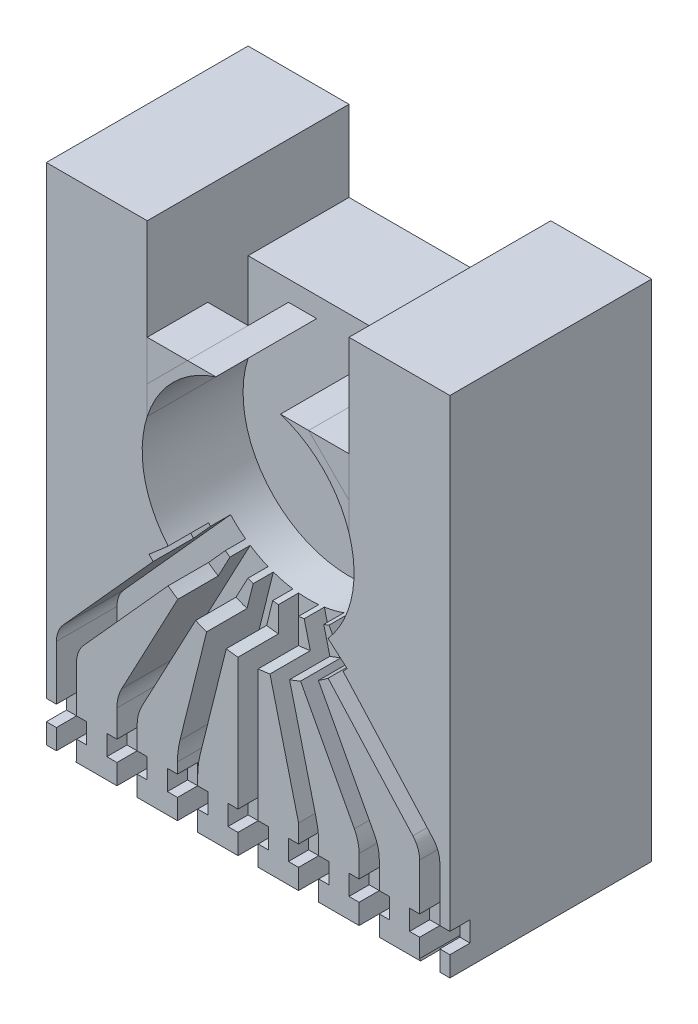
from build123d import *

# Parameters (mm, degrees)
BOSS_EXTRUDE1_DEPTH   = 100
SKETCH6_W             = 200
SKETCH6_H             = 100.00000000000001
BOSS_EXTRUDE2_DEPTH   = 50
CUT_EXTRUDE7_DEPTH    = 50
CUT_EXTRUDE13_DEPTH   = 50
CUT_EXTRUDE16_DEPTH   = 50
CUT_EXTRUDE17_DEPTH   = 50
BOSS_EXTRUDE5_DEPTH   = 100
SKETCH11_W            = 100
SKETCH11_H            = 50.00000000000001
CUT_EXTRUDE29_DEPTH   = 40
BOSS_EXTRUDE7_DEPTH   = 30
BOSS_EXTRUDE7_2_DEPTH = 30
BOSS_EXTRUDE8_START   = -70
BOSS_EXTRUDE8_DEPTH   = 70
SKETCH14_W            = 5.0000000000006395
SKETCH14_H            = 10
CUT_EXTRUDE31_DEPTH   = 10
SKETCH24_W            = 5.000000000000001
SKETCH24_H            = 10.000000000000014
SKETCH24_W_2          = 5
CUT_EXTRUDE32_DEPTH   = 10
CUT_EXTRUDE33_DEPTH   = 30
SKETCH13_R            = 10.000000000000002
CUT_EXTRUDE34_DEPTH   = 50
SKETCH28_R            = 52.49999999999999
SKETCH28_R_2          = 50
CUT_EXTRUDE35_DEPTH   = 50
CUT_EXTRUDE37_DEPTH   = 60
CUT_EXTRUDE39_DEPTH   = 20


with BuildPart() as part:
    # Sketch1 → Boss-Extrude1 (new body)
    with BuildSketch(Plane.XY):
        Polygon((-100.00000000000003, 100), (99.99999999999997, 100), (100, -100), (-100, -100), align=None)
    extrude(amount=-BOSS_EXTRUDE1_DEPTH)

    # Sketch6 → Boss-Extrude2 (add)
    with BuildSketch(Plane(origin=(0, 100, 0), x_dir=(1, 0, 0), z_dir=(0, 1, 0))):
        with Locations((-2.842e-14, 50.00000000000001)):
            Rectangle(SKETCH6_W, SKETCH6_H)
    extrude(amount=BOSS_EXTRUDE2_DEPTH)

    # Sketch8 → Cut-Extrude7 (cut)
    with BuildSketch(Plane.XY):
        with BuildLine():
            Line((0, 100), (-50, 100))
            Line((-49.99999999999999, 100), (-49.99999999999999, 50))
            ThreePointArc((-49.99999999999999, 50.00000000000001), (-35.35533905932736, 85.35533905932738), (-2.71e-15, 100))
        make_face()
        with BuildLine():
            Line((50.00000000000001, 50), (50, 100))
            Line((50, 100), (0, 100))
            ThreePointArc((-1.381e-14, 100), (35.35533905932738, 85.35533905932738), (50.00000000000001, 50))
        make_face()
        Polygon((49.99999999999999, 150.00000000000003), (-49.99999999999999, 150.00000000000003), (-49.99999999999999, 100), (0, 100), (50, 100), align=None)
    extrude(amount=-CUT_EXTRUDE7_DEPTH, mode=Mode.SUBTRACT)

    # Sketch3<9> → Cut-Extrude13 (cut)
    with BuildSketch(Plane.XY):
        with BuildLine():
            Line((9.18e-15, 50), (0, 100))
            ThreePointArc((1.14e-15, 100), (-2.503138752990941, 99.93730365551664), (-4.999999999999985, 99.74937185533099))
            ThreePointArc((-4.999999999999985, 99.74937185533099), (-37.0809924354783, 83.54101966249685), (-49.99999999999999, 50.00000000000001))
            Line((-49.99999999999999, 50), (-39.99999999999999, 50))
            Line((-39.99999999999999, 50), (-29.999999999999993, 50))
            Line((-29.999999999999993, 50), (-19.999999999999993, 50))
            Line((-19.999999999999993, 50), (-9.999999999999993, 50))
            Line((-9.999999999999993, 50), (9.18e-15, 50))
        make_face()
        with BuildLine():
            ThreePointArc((5.00000000000002, 99.74937185533099), (2.503138752990955, 99.93730365551664), (1.14e-15, 100))
            Line((0, 100), (9.18e-15, 50))
            Line((9.18e-15, 50), (10.000000000000007, 50))
            Line((10.000000000000007, 50), (20.000000000000007, 50))
            Line((20.000000000000007, 50), (30.000000000000007, 50))
            Line((30.000000000000007, 50), (40.00000000000001, 50))
            Line((40.00000000000001, 50), (50.00000000000001, 50))
            ThreePointArc((50.00000000000001, 50), (37.08099243547832, 83.54101966249684), (5.00000000000002, 99.74937185533099))
        make_face()
        with BuildLine():
            Line((-33.45653031794294, 12.842758726130342), (9.18e-15, 50))
            Line((9.18e-15, 50), (-9.999999999999993, 50))
            Line((-9.999999999999993, 50), (-19.999999999999993, 50))
            Line((-19.999999999999993, 50), (-29.999999999999993, 50))
            Line((-29.999999999999993, 50), (-39.99999999999999, 50))
            Line((-39.99999999999999, 50), (-49.99999999999999, 50))
            ThreePointArc((-49.99999999999999, 50.00000000000001), (-46.638115174960966, 31.97539978454238), (-37.00455148291699, 16.374664766754435))
            ThreePointArc((-37.00455148291699, 16.374664766754435), (-35.27477288667937, 14.564277941698585), (-33.4565303179427, 12.842758726130107))
        make_face()
        with BuildLine():
            Line((10.000000000000007, 50), (9.18e-15, 50))
            Line((9.18e-15, 50), (33.45653031794303, 12.842758726130398))
            ThreePointArc((33.4565303179428, 12.842758726130185), (35.274772886679195, 14.5642779416984), (37.004551482916575, 16.374664766753966))
            ThreePointArc((37.004551482916575, 16.374664766753966), (46.63811517496086, 31.975399784542073), (50.00000000000001, 49.999999999999986))
            Line((50.00000000000001, 50), (40.00000000000001, 50))
            Line((40.00000000000001, 50), (30.000000000000007, 50))
            Line((30.000000000000007, 50), (20.000000000000007, 50))
            Line((20.000000000000007, 50), (10.000000000000007, 50))
        make_face()
        with BuildLine():
            Line((-31.851655647969743, 11.458178137467897), (9.18e-15, 50))
            Line((9.18e-15, 50), (-33.45653031794294, 12.842758726130342))
            ThreePointArc((-33.4565303179427, 12.842758726130107), (-32.66143068500176, 12.141963262619853), (-31.85165564796974, 11.458178137467904))
        make_face()
        with BuildLine():
            Line((-28.678821817552357, 9.042397785550442), (9.18e-15, 50))
            Line((9.18e-15, 50), (-31.851655647969743, 11.458178137467897))
            ThreePointArc((-31.85165564796974, 11.458178137467904), (-30.28933268047004, 10.218643490049153), (-28.678821817552127, 9.042397785550293))
        make_face()
        with BuildLine():
            Line((-23.473578139294574, 5.852620357053681), (9.18e-15, 50))
            Line((9.18e-15, 50), (-28.678821817552357, 9.042397785550442))
            ThreePointArc((-28.678821817552127, 9.042397785550293), (-26.124928235797764, 7.36799178229559), (-23.47357813929539, 5.852620357054114))
        make_face()
        with BuildLine():
            Line((-12.096094779983398, 1.48521368620019), (9.18e-15, 50))
            Line((9.18e-15, 50), (-23.473578139294574, 5.852620357053681))
            ThreePointArc((-23.47357813929539, 5.852620357054114), (-17.918397477264612, 3.320978675139763), (-12.096094779981614, 1.4852136861997352))
        make_face()
        with BuildLine():
            Line((0, 0), (9.18e-15, 50))
            Line((9.18e-15, 50), (-12.096094779983398, 1.48521368620019))
            ThreePointArc((-12.096094779981614, 1.4852136861997352), (-6.093467170256468, 0.3726924179337914), (0, 0))
        make_face()
        with BuildLine():
            Line((12.096094779983442, 1.485213686200197), (9.18e-15, 50))
            Line((9.18e-15, 50), (0, 0))
            ThreePointArc((0, 0), (6.093467170256467, 0.37269241793378427), (12.096094779981614, 1.4852136861997352))
        make_face()
        with BuildLine():
            Line((23.47357813929465, 5.852620357053695), (9.18e-15, 50))
            Line((9.18e-15, 50), (12.096094779983442, 1.485213686200197))
            ThreePointArc((12.096094779981614, 1.4852136861997352), (17.91839747726453, 3.3209786751397274), (23.473578139295277, 5.852620357054036))
        make_face()
        with BuildLine():
            Line((31.851655647969828, 11.458178137467954), (9.18e-15, 50))
            Line((9.18e-15, 50), (23.47357813929465, 5.852620357053695))
            ThreePointArc((23.473578139295277, 5.852620357054036), (27.804243253706357, 8.443724215363993), (31.85165564796981, 11.458178137467954))
        make_face()
        with BuildLine():
            Line((33.45653031794303, 12.842758726130398), (9.18e-15, 50))
            Line((9.18e-15, 50), (31.851655647969828, 11.458178137467954))
            ThreePointArc((31.85165564796981, 11.458178137467954), (32.66143068500187, 12.141963262619925), (33.4565303179428, 12.842758726130185))
        make_face()
    extrude(amount=-CUT_EXTRUDE13_DEPTH, mode=Mode.SUBTRACT)

    # Sketch9 → Cut-Extrude16 (cut)
    with BuildSketch(Plane.XY):
        with BuildLine():
            Line((-37.00455148291699, 16.374664766754428), (-38.68540123985281, 14.507891991153953))
            ThreePointArc((-38.68540123985282, 14.507891991153947), (-3.0986e-13, -2.500000000000007), (38.685401239852396, 14.507891991153485))
            Line((38.68540123985239, 14.507891991153473), (37.004551482916575, 16.374664766753963))
            ThreePointArc((37.004551482916575, 16.374664766753945), (-3.2005e-13, -2.132e-14), (-37.004551482917, 16.37466476675442))
        make_face()
    extrude(amount=-CUT_EXTRUDE16_DEPTH, mode=Mode.SUBTRACT)

    # Sketch3<12> → Cut-Extrude17 (cut)
    with BuildSketch(Plane.XY):
        with BuildLine():
            ThreePointArc((5.0000000000000195, -2.2613624009171787), (1.51e-14, -2.5), (-4.99999999999999, -2.2613624009171787))
            Line((-4.99999999999999, -2.2613624009171702), (-4.99999999999999, -100))
            Line((-4.99999999999999, -100), (5.000000000000019, -100))
            Line((5.000000000000019, -100), (5.000000000000019, -2.2613624009171645))
        make_face()
        with BuildLine():
            ThreePointArc((-31.25395298507802, 7.816585927564702), (-35.12935683383976, 10.98489666243654), (-38.685401239852816, 14.507891991153947))
            Line((-38.68540123985281, 14.507891991153953), (-91.65434696820584, -44.32008203206311))
            ThreePointArc((-91.65434696820584, -44.32008203206311), (-94.13485547693077, -48.36790402696407), (-94.99999999999939, -53.03580615944982))
            Line((-94.99999999999939, -53.03580615944982), (-94.99999999999939, -100))
            Line((-94.99999999999939, -100), (-85.4192650026672, -100))
            Line((-85.4192650026672, -100), (-84.99999999999939, -99.21147721348915))
            Line((-84.99999999999939, -99.21147721348915), (-84.99999999999937, -56.87444650980339))
            ThreePointArc((-84.99999999999937, -56.87444650980339), (-84.13485547693067, -52.20654437731811), (-81.65434696820557, -48.15872238241778))
            Line((-81.65434696820557, -48.15872238241778), (-31.25395298507801, 7.8165859275647165))
        make_face()
        with BuildLine():
            ThreePointArc((38.68540123985238, 14.507891991153478), (35.129356833840156, 10.984896662436888), (31.253952985079387, 7.816585927565711))
            Line((31.25395298507938, 7.816585927565713), (81.65434696820574, -48.158722382416414))
            ThreePointArc((81.65434696820574, -48.158722382416414), (84.13485547693118, -52.20654437731739), (85, -56.8744465098034))
            Line((85, -56.8744465098034), (85, -99.21147721348999))
            Line((85, -99.21147721348997), (85.41926500266737, -100))
            Line((85.41926500266737, -100), (95, -100))
            Line((95, -100), (94.99999999999991, -53.03580615945003))
            ThreePointArc((94.99999999999991, -53.03580615945003), (94.13485547693111, -48.36790402696403), (91.6543469682056, -44.320082032063105))
            Line((91.6543469682056, -44.320082032063105), (38.68540123985239, 14.507891991153478))
        make_face()
        with BuildLine():
            ThreePointArc((28.949961443973052, 6.203313682511627), (24.6472570462596, 3.6452513749065076), (20.1204855153844, 1.508598054652964))
            Line((20.120485515384395, 1.508598054652964), (52.652642186070594, -59.67548997069998))
            ThreePointArc((52.652642186070594, -59.67548997069998), (54.40431332651623, -64.23874930361463), (55.00000000000005, -69.09022793499462))
            Line((55.00000000000005, -69.09022793499462), (55.00000000000005, -100))
            Line((55.00000000000006, -100), (65, -100))
            Line((65, -100), (64.99999999999999, -66.59694790656346))
            ThreePointArc((64.99999999999999, -66.59694790656346), (64.40431332651615, -61.745469275183424), (62.652642186070466, -57.18220994226872))
            Line((62.65264218607047, -57.18220994226872), (28.949961443973045, 6.203313682511634))
        make_face()
        with BuildLine():
            Line((-17.494646490031172, 0.5006328910273916), (-33.79039052200022, -64.85802657017483))
            ThreePointArc((-33.79039052200022, -64.85802657017483), (-34.69646638372632, -69.74677444335386), (-34.99999999999997, -74.70950520156622))
            Line((-34.99999999999997, -74.70950520156622), (-35.00000000000001, -100))
            Line((-35.00000000000001, -100), (-25.000000000000007, -100))
            Line((-25.000000000000007, -100), (-24.99999999999997, -75.93735081059135))
            ThreePointArc((-24.999999999999975, -75.93735081059135), (-24.696466383726506, -70.97462005238268), (-23.79039052200113, -66.08587217920726))
            Line((-23.790390522001125, -66.08587217920726), (-7.791689227271171, -1.918586064969304))
            ThreePointArc((-7.7916892272711715, -1.9185860649693183), (-12.700899518982641, -0.940525629489791), (-17.494646490031172, 0.5006328910273936))
        make_face()
        with BuildLine():
            ThreePointArc((17.494646490028806, 0.5006328910265552), (12.700899518981458, -0.9405256294900823), (7.791689227271249, -1.9185860649693112))
            Line((7.791689227271249, -1.9185860649692938), (25.000000000000686, -70.93735081059185))
            Line((25.0000000000007, -70.93735081059185), (25.000000000000494, -100))
            Line((25.000000000000494, -100), (35.00000000000003, -100))
            Line((35.00000000000003, -100), (35.00000000000004, -74.70950520156617))
            ThreePointArc((35.00000000000004, -74.70950520156617), (34.6964663837267, -69.74677444335956), (33.79039052200163, -64.8580265701862))
            Line((33.79039052200162, -64.8580265701862), (17.494646490028806, 0.5006328910265552))
        make_face()
        with BuildLine():
            ThreePointArc((-20.12048551538437, 1.508598054652957), (-24.6472570462596, 3.6452513749065076), (-28.94996144397308, 6.203313682511649))
            Line((-28.949961443973077, 6.203313682511647), (-55.000000000000036, -42.78968325310052))
            Line((-55.00000000000005, -42.78968325310051), (-62.65264218607062, -57.18220994226922))
            ThreePointArc((-62.65264218607062, -57.18220994226922), (-64.40431332651619, -61.74546927518374), (-64.99999999999999, -66.59694790656357))
            Line((-64.99999999999999, -66.59694790656357), (-64.99999999999999, -72.24722024751124))
            Line((-64.99999999999999, -72.24722024751124), (-65, -100))
            Line((-65, -100), (-55.000000000000036, -100))
            Line((-55.000000000000036, -100), (-55.000000000000036, -69.09022793499462))
            ThreePointArc((-55.000000000000036, -69.09022793499462), (-54.404313326516174, -64.23874930361461), (-52.65264218607042, -59.675489970699985))
            Line((-52.65264218607042, -59.675489970699985), (-20.120485515384367, 1.508598054652957))
        make_face()
    extrude(amount=-CUT_EXTRUDE17_DEPTH, mode=Mode.SUBTRACT)

    # Sketch11 → Cut-Extrude29 (cut)
    with BuildSketch(Plane(origin=(0, 150.00000000000003, 0), x_dir=(1, 0, 0), z_dir=(0, 1, 0))):
        with Locations((7.11e-15, 75.00000000000001)):
            Rectangle(SKETCH11_W, SKETCH11_H)
    extrude(amount=-CUT_EXTRUDE29_DEPTH, mode=Mode.SUBTRACT)

    # Sketch20 → Boss-Extrude8 (add)
    with BuildSketch(Plane(origin=(0, 0, -100), x_dir=(-1, 0, 0), z_dir=(0, 0, -1)).offset(BOSS_EXTRUDE8_START)):
        with BuildLine():
            Line((-94.99999999999991, -53.03580615945003), (-95, -100))
            Line((-95, -100), (-85, -100))
            Line((-85, -100), (-85, -56.8744465098034))
            ThreePointArc((-85, -56.8744465098034), (-84.13485547693118, -52.20654437731739), (-81.65434696820574, -48.158722382416414))
            Line((-81.65434696820574, -48.158722382416414), (-31.25395298507938, 7.816585927565711))
            ThreePointArc((-31.253952985079376, 7.816585927565718), (-35.12935683384015, 10.984896662436888), (-38.68540123985237, 14.507891991153478))
            Line((-38.68540123985239, 14.507891991153473), (-91.6543469682056, -44.32008203206311))
            ThreePointArc((-91.6543469682056, -44.320082032063105), (-94.13485547693108, -48.36790402696404), (-94.99999999999991, -53.03580615945003))
        make_face()
        with BuildLine():
            Line((-64.99999999999999, -66.59694790656346), (-65, -100))
            Line((-65, -100), (-55.00000000000005, -100))
            Line((-55.00000000000005, -100), (-55.00000000000005, -69.09022793499462))
            ThreePointArc((-55.00000000000005, -69.09022793499462), (-54.40431332651623, -64.23874930361463), (-52.652642186070594, -59.67548997069998))
            Line((-52.652642186070594, -59.67548997069998), (-20.120485515384395, 1.508598054652964))
            ThreePointArc((-20.120485515384395, 1.5085980546529711), (-24.647257046259593, 3.645251374906522), (-28.949961443973045, 6.203313682511634))
            Line((-28.949961443973045, 6.203313682511633), (-62.65264218607047, -57.18220994226872))
            ThreePointArc((-62.65264218607047, -57.18220994226873), (-64.40431332651616, -61.74546927518342), (-64.99999999999999, -66.59694790656346))
        make_face()
        with BuildLine():
            Line((-35.000000000000036, -74.70950520156617), (-35.00000000000003, -100))
            Line((-35.00000000000003, -100), (-25.000000000000497, -100))
            Line((-25.000000000000494, -100), (-25.000000000000743, -75.93735081059184))
            ThreePointArc((-25.000000000000746, -75.93735081059184), (-24.69646638372746, -70.97462005238522), (-23.79039052200239, -66.08587217921186))
            Line((-23.79039052200239, -66.08587217921186), (-7.791689227271249, -1.9185860649692938))
            ThreePointArc((-7.7916892272712515, -1.918586064969297), (-12.700899518981458, -0.9405256294900823), (-17.494646490028806, 0.5006328910265623))
            Line((-17.494646490028806, 0.5006328910265521), (-33.790390522001616, -64.8580265701862))
            ThreePointArc((-33.790390522001616, -64.8580265701862), (-34.69646638372669, -69.74677444335956), (-35.00000000000003, -74.70950520156617))
        make_face()
        with BuildLine():
            Line((-5.000000000000019, -2.2613624009171702), (-5.000000000000019, -100))
            Line((-5.000000000000014, -100), (4.999999999999986, -100))
            Line((4.99999999999999, -100), (4.99999999999999, -2.2613624009171645))
            ThreePointArc((4.999999999999985, -2.2613624009171716), (-1.676e-14, -2.499999999999986), (-5.000000000000019, -2.2613624009171645))
        make_face()
        with BuildLine():
            Line((24.99999999999997, -75.93735081059135), (25.000000000000007, -100))
            Line((25, -100), (35, -100))
            Line((35.00000000000001, -100), (34.99999999999997, -74.70950520156622))
            ThreePointArc((34.99999999999997, -74.70950520156622), (34.6964663837263, -69.74677444335386), (33.79039052200024, -64.85802657017483))
            Line((33.79039052200023, -64.85802657017483), (17.494646490031172, 0.5006328910273936))
            ThreePointArc((17.49464649003117, 0.5006328910274007), (12.700899518982647, -0.9405256294897697), (7.791689227271172, -1.918586064969304))
            Line((7.79168922727117, -1.9185860649693076), (23.79039052200112, -66.08587217920726))
            ThreePointArc((23.790390522001125, -66.08587217920726), (24.696466383726516, -70.97462005238268), (24.99999999999997, -75.93735081059135))
        make_face()
        with BuildLine():
            Line((62.65264218607062, -57.18220994226922), (28.94996144397308, 6.203313682511649))
            ThreePointArc((28.949961443973084, 6.203313682511656), (24.64725704625959, 3.645251374906522), (20.120485515384367, 1.508598054652964))
            Line((20.120485515384367, 1.508598054652957), (52.65264218607042, -59.675489970699985))
            ThreePointArc((52.65264218607042, -59.675489970699985), (54.404313326516174, -64.23874930361461), (55.00000000000004, -69.09022793499462))
            Line((55.000000000000036, -69.09022793499462), (55.000000000000036, -100))
            Line((55.00000000000003, -100), (65, -100))
            Line((65, -100), (64.99999999999999, -66.59694790656357))
            ThreePointArc((64.99999999999999, -66.59694790656357), (64.40431332651619, -61.74546927518374), (62.65264218607062, -57.18220994226922))
        make_face()
        with BuildLine():
            Line((91.65434696820584, -44.32008203206311), (38.68540123985281, 14.507891991153953))
            ThreePointArc((38.68540123985281, 14.507891991153961), (35.12935683383975, 10.984896662436547), (31.25395298507801, 7.816585927564709))
            Line((31.25395298507801, 7.8165859275647165), (81.65434696820557, -48.15872238241778))
            ThreePointArc((81.65434696820557, -48.15872238241778), (84.13485547693068, -52.206544377318096), (84.99999999999937, -56.87444650980339))
            Line((84.99999999999937, -56.87444650980339), (84.99999999999939, -100))
            Line((84.99999999999937, -100), (94.99999999999937, -100))
            Line((94.99999999999939, -100), (94.99999999999942, -55.508188908772404))
            Line((94.99999999999942, -55.508188908772404), (94.99999999999939, -53.03580615944982))
            ThreePointArc((94.99999999999939, -53.03580615944982), (94.13485547693105, -48.367904026963956), (91.65434696820584, -44.32008203206311))
        make_face()
    extrude(amount=BOSS_EXTRUDE8_DEPTH)

    # Sketch14 → Cut-Extrude31 (cut)
    with BuildSketch(Plane.XY):
        with Locations((-97.49999999999972, -85.00000000000001)):
            Rectangle(SKETCH14_W, SKETCH14_H)
        Polygon((-84.99999999999937, -90.00000000000001), (-84.99999999999937, -80.00000000000001), (-79.99999999999939, -80.00000000000001), (-79.99999999999939, -90.00000000000004), align=None)
        Polygon((-64.99999999999999, -80.00000000000001), (-65, -90.00000000000001), (-70, -90.00000000000001), (-70, -80.00000000000001), align=None)
        Polygon((-55.00000000000003, -90.00000000000001), (-50.000000000000036, -90.00000000000001), (-50.000000000000036, -80.00000000000001), (-55.000000000000036, -80.00000000000001), align=None)
        Polygon((-40.00000000000001, -90.00000000000001), (-34.99999999999999, -90.00000000000001), (-34.99999999999997, -80.00000000000001), (-40.00000000000001, -80.00000000000001), align=None)
        Polygon((-24.99999999999999, -90.00000000000001), (-20.000000000000007, -90.00000000000001), (-20.000000000000007, -80.00000000000001), (-24.999999999999982, -80.00000000000001), align=None)
        Polygon((-9.999999999999991, -90.00000000000001), (-4.99999999999999, -90.00000000000003), (-4.99999999999999, -80.00000000000001), (-9.999999999999991, -80.00000000000001), align=None)
    extrude(amount=-CUT_EXTRUDE31_DEPTH, mode=Mode.SUBTRACT)

    # Sketch24 → Cut-Extrude32 (cut)
    with BuildSketch(Plane.XY):
        with Locations((7.5000000000000195, -85.00000000000003)):
            Rectangle(SKETCH24_W, SKETCH24_H)
        Polygon((20.000000000000494, -80.00000000000001), (20.00000000000049, -90.00000000000003), (25.000000000000597, -90.00000000000003), (25.000000000000703, -80.00000000000001), align=None)
        Polygon((35.00000000000003, -90.00000000000003), (35.00000000000002, -80.00000000000001), (40.00000000000003, -80.00000000000001), (40.00000000000002, -90.00000000000003), align=None)
        Polygon((50.00000000000005, -80.00000000000001), (50.00000000000004, -90.00000000000003), (55.00000000000004, -90.00000000000003), (55.00000000000005, -80.00000000000001), align=None)
        Polygon((70, -80.00000000000001), (70, -90.00000000000003), (64.99999999999999, -90.00000000000003), (65, -80.00000000000001), align=None)
        with Locations((82.5, -85.00000000000003)):
            Rectangle(SKETCH24_W_2, SKETCH24_H)
        Polygon((94.99999999999996, -80.00000000000001), (100, -80.00000000000001), (100, -90.00000000000003), (94.99999999999999, -90.00000000000003), align=None)
    extrude(amount=-CUT_EXTRUDE32_DEPTH, mode=Mode.SUBTRACT)


with BuildPart() as body_2:
    # Sketch3<16> → Boss-Extrude5 (new body)
    with BuildSketch(Plane.XY):
        with BuildLine():
            Line((-4.99999999999999, 99.749371855331), (-4.99999999999999, 100))
            Line((-4.999999999999986, 100), (-30, 100))
            Line((-29.999999999999996, 100), (-49.99999999999999, 80))
            Line((-49.99999999999999, 80), (-49.99999999999999, 50))
            ThreePointArc((-49.99999999999999, 50.00000000000001), (-37.0809924354783, 83.54101966249685), (-4.999999999999985, 99.74937185533099))
        make_face()
        with BuildLine():
            Line((30, 100), (5.000000000000014, 100))
            Line((5.000000000000019, 100), (5.000000000000019, 99.749371855331))
            ThreePointArc((5.00000000000002, 99.74937185533099), (37.08099243547832, 83.54101966249684), (50.00000000000001, 50))
            Line((50.00000000000001, 50), (50, 80))
            Line((50, 80), (30.000000000000004, 100))
        make_face()
        with BuildLine():
            Line((5.000000000000014, 100), (0, 100))
            ThreePointArc((1.14e-15, 100), (2.503138752990955, 99.93730365551664), (5.00000000000002, 99.74937185533099))
            Line((5.000000000000019, 99.749371855331), (5.000000000000019, 100))
        make_face()
        with BuildLine():
            ThreePointArc((-4.999999999999985, 99.74937185533099), (-2.503138752990941, 99.93730365551664), (1.14e-15, 100))
            Line((0, 100), (-4.999999999999986, 100))
            Line((-4.99999999999999, 100), (-4.99999999999999, 99.749371855331))
        make_face()
    extrude(amount=-BOSS_EXTRUDE5_DEPTH)


with BuildPart() as body_3:
    # Sketch3 → Boss-Extrude7 (new body)
    with BuildSketch(Plane.XY):
        Polygon((-29.999999999999996, 100), (-49.99999999999999, 80), (-49.99999999999999, 100), align=None)
    extrude(amount=-BOSS_EXTRUDE7_DEPTH)


with BuildPart() as body_4:
    # Sketch3 → Boss-Extrude7 2 (new body)
    with BuildSketch(Plane.XY):
        Polygon((50, 100), (30, 100), (50, 80), align=None)
    extrude(amount=-BOSS_EXTRUDE7_2_DEPTH)


with BuildPart() as cut_extrude33_tool:
    # Sketch13<5> → Cut-Extrude33 (new body)
    with BuildSketch(Plane(origin=(0, 0, -100), x_dir=(-1, 0, 0), z_dir=(0, 0, -1))):
        Polygon((-50, 100), (-50, 50), (-50, 0), (50, -1.388e-14), (49.99999999999999, 100), align=None)
    extrude(amount=-CUT_EXTRUDE33_DEPTH)


with BuildPart() as part_1:
    add(part.part)

    # Cut-Extrude33: cut by cut_extrude33_tool
    add(cut_extrude33_tool.part, mode=Mode.SUBTRACT)

    # Sketch13 → Cut-Extrude34 (cut)
    with BuildSketch(Plane(origin=(0, 0, -100), x_dir=(-1, 0, 0), z_dir=(0, 0, -1))):
        with Locations((-9.18e-15, 50)):
            Circle(SKETCH13_R)
    extrude(amount=-CUT_EXTRUDE34_DEPTH, mode=Mode.SUBTRACT)


with BuildPart() as body_2_1:
    add(body_2.part)

    # Cut-Extrude33: cut by cut_extrude33_tool
    add(cut_extrude33_tool.part, mode=Mode.SUBTRACT)


with BuildPart() as cut_extrude35_tool:
    # Sketch28 → Cut-Extrude35 (new body)
    with BuildSketch(Plane.XY):
        with Locations((9.18e-15, 50)):
            Circle(SKETCH28_R)
        with Locations((9.18e-15, 50)):
            Circle(SKETCH28_R_2, mode=Mode.SUBTRACT)
    extrude(amount=-CUT_EXTRUDE35_DEPTH)


with BuildPart() as part_2:
    add(part_1.part)

    # Cut-Extrude35: cut by cut_extrude35_tool
    add(cut_extrude35_tool.part, mode=Mode.SUBTRACT)

    # Sketch29 → Cut-Extrude37 (cut)
    with BuildSketch(Plane(origin=(0, 0, -100), x_dir=(-1, 0, 0), z_dir=(0, 0, -1))):
        Polygon((90.00000000000004, -9.99999999999998), (-90.00000000000001, -9.999999999999995), (-89.99999999999999, -90.00000000000001), (90.00000000000004, -90.00000000000001), align=None)
    extrude(amount=-CUT_EXTRUDE37_DEPTH, mode=Mode.SUBTRACT)

    # Sketch30 → Cut-Extrude39 (cut)
    with BuildSketch(Plane.XY):
        with BuildLine():
            Line((37.282468362817724, -3.2448828787847006), (30.112762908429684, 6.994517674827769))
            ThreePointArc((30.112762908429925, 6.994517674827939), (0.7032266709959489, -2.4952900006200522), (-28.949961443973088, 6.203313682511663))
            Line((-28.949961443973077, 6.203313682511647), (-34.83997260121135, -4.874186182091526))
            ThreePointArc((-34.83997260121138, -4.874186182091513), (1.4680271454943008, -14.983420164685825), (37.28246836281792, -3.2448828787845585))
        make_face()
        with BuildLine():
            ThreePointArc((-28.949961443973088, 6.203313682511663), (-29.53401179862548, 6.595021632551763), (-30.11276290842996, 6.994517674827975))
            Line((-30.112762908429964, 6.994517674827984), (-35.01037691048559, -6.94e-15))
            Line((-35.01037691048559, -6.94e-15), (-37.282468362818044, -3.2448828787844386))
            ThreePointArc((-37.28246836281807, -3.2448828787844377), (-36.07042112265977, -4.07332725137212), (-34.83997260121138, -4.874186182091513))
            Line((-34.83997260121135, -4.874186182091526), (-28.949961443973077, 6.203313682511647))
        make_face()
        with BuildLine():
            ThreePointArc((-30.11276290842996, 6.994517674827975), (-30.68611092891489, 7.40173012834525), (-31.253952985077994, 7.816585927564695))
            Line((-31.253952985077994, 7.816585927564714), (-39.64889540441419, -1.5069421846203719))
            ThreePointArc((-39.6488954044142, -1.506942184620378), (-38.47549599726637, -2.389275694213822), (-37.28246836281807, -3.2448828787844377))
            Line((-37.282468362818044, -3.2448828787844386), (-35.01037691048559, -6.94e-15))
            Line((-35.01037691048559, -6.94e-15), (-30.112762908429964, 6.994517674827984))
        make_face()
        with BuildLine():
            ThreePointArc((-31.253952985077994, 7.816585927564695), (-33.22943730876026, 9.354526744750892), (-35.12935683384109, 10.984896662437748))
            Line((-35.1293568338401, 10.98489666243686), (-43.49348941332586, 1.695586343969417))
            ThreePointArc((-43.493489413326564, 1.6955863439700423), (-41.60202020983394, 0.05731370400093994), (-39.6488954044142, -1.506942184620378))
            Line((-39.64889540441419, -1.5069421846203719), (-31.253952985077994, 7.816585927564714))
        make_face()
        with BuildLine():
            ThreePointArc((-35.12935683384109, 10.984896662437748), (-36.94939108281797, 12.703988167513536), (-38.68540123985279, 14.507891991153933))
            Line((-38.685401239852794, 14.507891991153924), (-47.0803436591889, 5.184363878968826))
            ThreePointArc((-47.080343659188905, 5.184363878968824), (-45.320499793516746, 3.4054477597879327), (-43.493489413326564, 1.6955863439700423))
            Line((-43.49348941332586, 1.695586343969417), (-35.1293568338401, 10.98489666243686))
        make_face()
        with BuildLine():
            Line((-47.0803436591889, 5.184363878968826), (-38.685401239852794, 14.507891991153924))
            ThreePointArc((-38.68540123985279, 14.507891991153933), (-39.15734007310625, 15.029259109948697), (-39.62225296169439, 15.556900977997081))
            Line((-39.62225296169534, 15.556900977998133), (-49.056122714479976, 7.356163115616702))
            ThreePointArc((-49.05612271447937, 7.356163115616063), (-48.08049729032489, 6.259106315541928), (-47.080343659188905, 5.184363878968824))
        make_face()
        with BuildLine():
            ThreePointArc((38.68540123985237, 14.507891991153457), (34.60360596741044, 10.517846385332568), (30.112762908429925, 6.994517674827939))
            Line((30.112762908429684, 6.994517674827769), (37.282468362817724, -3.2448828787847006))
            ThreePointArc((37.28246836281792, -3.2448828787845585), (42.39143856123391, 0.7256056687742216), (47.08034365918844, 5.184363878968327))
            Line((47.08034365918847, 5.18436387896835), (38.68540123985238, 14.507891991153473))
        make_face()
        with BuildLine():
            Line((49.05612271447999, 7.356163115616759), (39.62225296169537, 15.556900977998161))
            ThreePointArc((39.62225296169439, 15.556900977997067), (39.157340073106035, 15.029259109948441), (38.68540123985237, 14.507891991153457))
            Line((38.68540123985238, 14.507891991153473), (47.08034365918847, 5.18436387896835))
            ThreePointArc((47.08034365918844, 5.184363878968327), (48.08049729032465, 6.259106315541658), (49.05612271447937, 7.356163115616042))
        make_face()
    extrude(amount=-CUT_EXTRUDE39_DEPTH, mode=Mode.SUBTRACT)


with BuildPart() as body_2_2:
    add(body_2_1.part)

    # Cut-Extrude35: cut by cut_extrude35_tool
    add(cut_extrude35_tool.part, mode=Mode.SUBTRACT)


solid = Compound([body_3.part, body_4.part, part_2.part, body_2_2.part])
